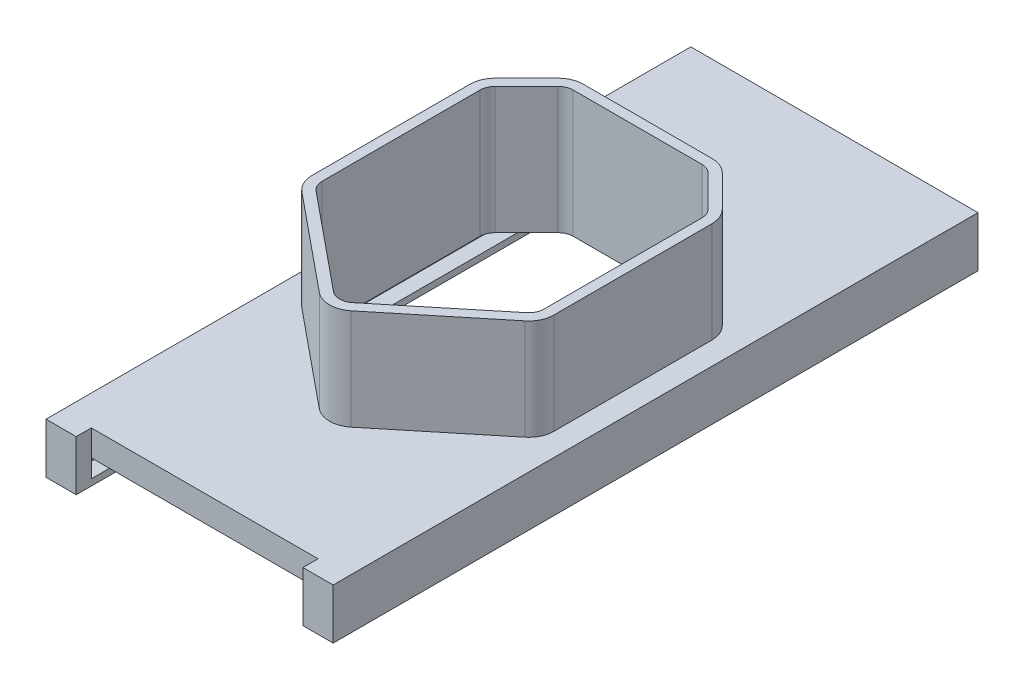
from build123d import *

# Parameters (mm, degrees)
BOSS_EXTRUDE1_DEPTH = 10
SKETCH2_W           = 3
SKETCH2_H           = 122
BOSS_EXTRUDE2_DEPTH = 1.25
SKETCH3_W           = 6
SKETCH3_H           = 10
BOSS_EXTRUDE3_DEPTH = 3
SKETCH4_W           = 122
SKETCH4_H           = 5.15
BOSS_EXTRUDE4_DEPTH = 52
CUT_EXTRUDE1_DEPTH  = 52
BOSS_EXTRUDE6_START = 20
BOSS_EXTRUDE6_DEPTH = 20


with BuildPart() as part:
    # Sketch1 → Boss-Extrude1 (new body)
    with BuildSketch(Plane(origin=(0, 0, 0), x_dir=(1, 0, 0), z_dir=(0, 1, 0))):
        Polygon((-28.5, 64), (28.5, 64), (28.5, -61), (25.5, -61), (25.5, 61), (-25.5, 61), (-25.5, -61), (-28.5, -61), align=None)
    extrude(amount=BOSS_EXTRUDE1_DEPTH)

    # Sketch2 → Boss-Extrude2 (add)
    with BuildSketch(Plane.XZ):
        with Locations((-24, 0)):
            Rectangle(SKETCH2_W, SKETCH2_H)
        with Locations((24, 0)):
            Rectangle(SKETCH2_W, SKETCH2_H)
    extrude(amount=-BOSS_EXTRUDE2_DEPTH)

    # Sketch3 → Boss-Extrude3 (add)
    with BuildSketch(Plane.XY.offset(61)):
        with Locations((-25.5, 5)):
            Rectangle(SKETCH3_W, SKETCH3_H)
        with Locations((25.5, 5)):
            Rectangle(SKETCH3_W, SKETCH3_H)
    extrude(amount=BOSS_EXTRUDE3_DEPTH)

    # Sketch4 → Boss-Extrude4 (add)
    with BuildSketch(Plane(origin=(-25.5, 0, 0), x_dir=(0, 0, -1), z_dir=(1, 0, 0))):
        with Locations((0, 7.425)):
            Rectangle(SKETCH4_W, SKETCH4_H)
    extrude(amount=BOSS_EXTRUDE4_DEPTH)

    # Sketch5 → Cut-Extrude1 (cut)
    with BuildSketch(Plane(origin=(0, 10, 0), x_dir=(1, 0, 0), z_dir=(0, 1, 0))):
        with BuildLine():
            Line((-22, 15.667860965), (-22, -15.667860965))
            ThreePointArc((-22, -15.667860965), (-21.711009048, -16.952551567), (-20.899713371, -17.989732863))
            Line((-20.899713371, -17.989732863), (-1.899713371, -33.535187408))
            ThreePointArc((-1.899713371, -33.535187408), (0, -34.213315511), (1.899713371, -33.535187408))
            Line((1.899713371, -33.535187408), (20.899713371, -17.989732863))
            ThreePointArc((20.899713371, -17.989732863), (21.711009048, -16.952551567), (22, -15.667860965))
            Line((22, -15.667860965), (22, 15.667860965))
            ThreePointArc((22, 15.667860965), (21.771638598, 16.815911262), (21.121320344, 17.789181309))
            Line((21.121320344, 17.789181309), (14.878679656, 24.031821996))
            ThreePointArc((14.878679656, 24.031821996), (13.90540961, 24.68214025), (12.757359313, 24.910501652))
            Line((12.757359313, 24.910501652), (-12.757359313, 24.910501652))
            ThreePointArc((-12.757359313, 24.910501652), (-13.90540961, 24.68214025), (-14.878679656, 24.031821996))
            Line((-14.878679656, 24.031821996), (-21.121320344, 17.789181309))
            ThreePointArc((-21.121320344, 17.789181309), (-21.771638598, 16.815911262), (-22, 15.667860965))
        make_face()
    extrude(amount=-CUT_EXTRUDE1_DEPTH, mode=Mode.SUBTRACT)

    # Sketch6 → Boss-Extrude6 (add)
    with BuildSketch(Plane(origin=(0, 10, 0), x_dir=(1, 0, 0), z_dir=(0, 1, 0)).offset(BOSS_EXTRUDE6_START)):
        with BuildLine():
            Line((-22.166188951, -19.537647461), (-3.166188951, -35.083102007))
            ThreePointArc((-3.166188951, -35.083102007), (0, -36.213315511), (3.166188951, -35.083102007))
            Line((3.166188951, -35.083102007), (22.166188951, -19.537647461))
            ThreePointArc((22.166188951, -19.537647461), (23.518348413, -17.809011969), (24, -15.667860965))
            Line((24, -15.667860965), (24, 15.667860965))
            ThreePointArc((24, 15.667860965), (23.619397663, 17.581278127), (22.535533906, 19.203394871))
            Line((22.535533906, 19.203394871), (16.292893219, 25.446035558))
            ThreePointArc((16.292893219, 25.446035558), (14.670776475, 26.529899315), (12.757359313, 26.910501652))
            Line((12.757359313, 26.910501652), (-12.757359313, 26.910501652))
            ThreePointArc((-12.757359313, 26.910501652), (-14.670776475, 26.529899315), (-16.292893219, 25.446035558))
            Line((-16.292893219, 25.446035558), (-22.535533906, 19.203394871))
            ThreePointArc((-22.535533906, 19.203394871), (-23.619397663, 17.581278127), (-24, 15.667860965))
            Line((-24, 15.667860965), (-24, -15.667860965))
            ThreePointArc((-24, -15.667860965), (-23.518348413, -17.809011969), (-22.166188951, -19.537647461))
        make_face()
        with BuildLine():
            Line((-20.899713371, -17.989732863), (-1.899713371, -33.535187408))
            ThreePointArc((-1.899713371, -33.535187408), (0, -34.213315511), (1.899713371, -33.535187408))
            Line((1.899713371, -33.535187408), (20.899713371, -17.989732863))
            ThreePointArc((20.899713371, -17.989732863), (21.711009048, -16.952551567), (22, -15.667860965))
            Line((22, -15.667860965), (22, 15.667860965))
            ThreePointArc((22, 15.667860965), (21.771638598, 16.815911262), (21.121320344, 17.789181309))
            Line((21.121320344, 17.789181309), (14.878679656, 24.031821996))
            ThreePointArc((14.878679656, 24.031821996), (13.90540961, 24.68214025), (12.757359313, 24.910501652))
            Line((12.757359313, 24.910501652), (-12.757359313, 24.910501652))
            ThreePointArc((-12.757359313, 24.910501652), (-13.90540961, 24.68214025), (-14.878679656, 24.031821996))
            Line((-14.878679656, 24.031821996), (-21.121320344, 17.789181309))
            ThreePointArc((-21.121320344, 17.789181309), (-21.771638598, 16.815911262), (-22, 15.667860965))
            Line((-22, 15.667860965), (-22, -15.667860965))
            ThreePointArc((-22, -15.667860965), (-21.711009048, -16.952551567), (-20.899713371, -17.989732863))
        make_face(mode=Mode.SUBTRACT)
    extrude(amount=-BOSS_EXTRUDE6_DEPTH)


solid = part.part
